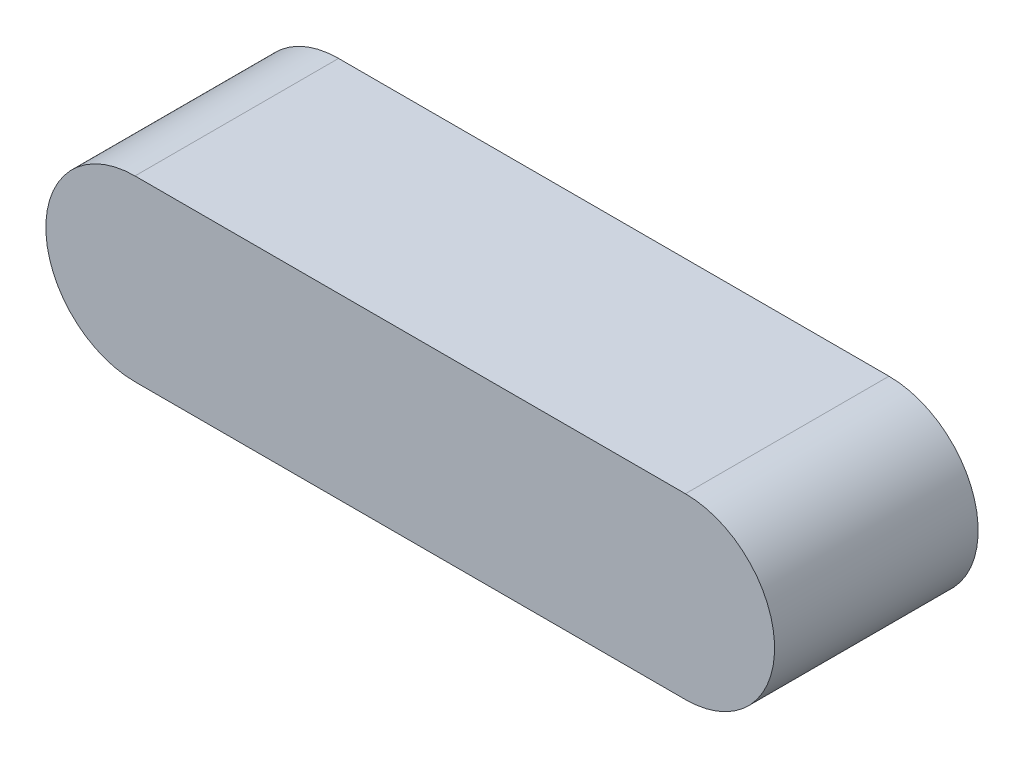
from build123d import *

# Parameters (mm, degrees)
CURVEBOSS_DEPTH = 11.731


with BuildPart() as part:
    # CurveSketch → CurveBoss (new body)
    with BuildSketch(Plane.XY):
        with BuildLine():
            Line((-8.6665, -18.856), (23.0525, -18.856))
            ThreePointArc((23.0525, -18.856), (28.1895, -13.719), (23.0525, -8.582))
            Line((23.0525, -8.582), (-8.6665, -8.582))
            ThreePointArc((-8.6665, -8.582), (-13.8035, -13.719), (-8.6665, -18.856))
        make_face()
    extrude(amount=CURVEBOSS_DEPTH)


solid = part.part
